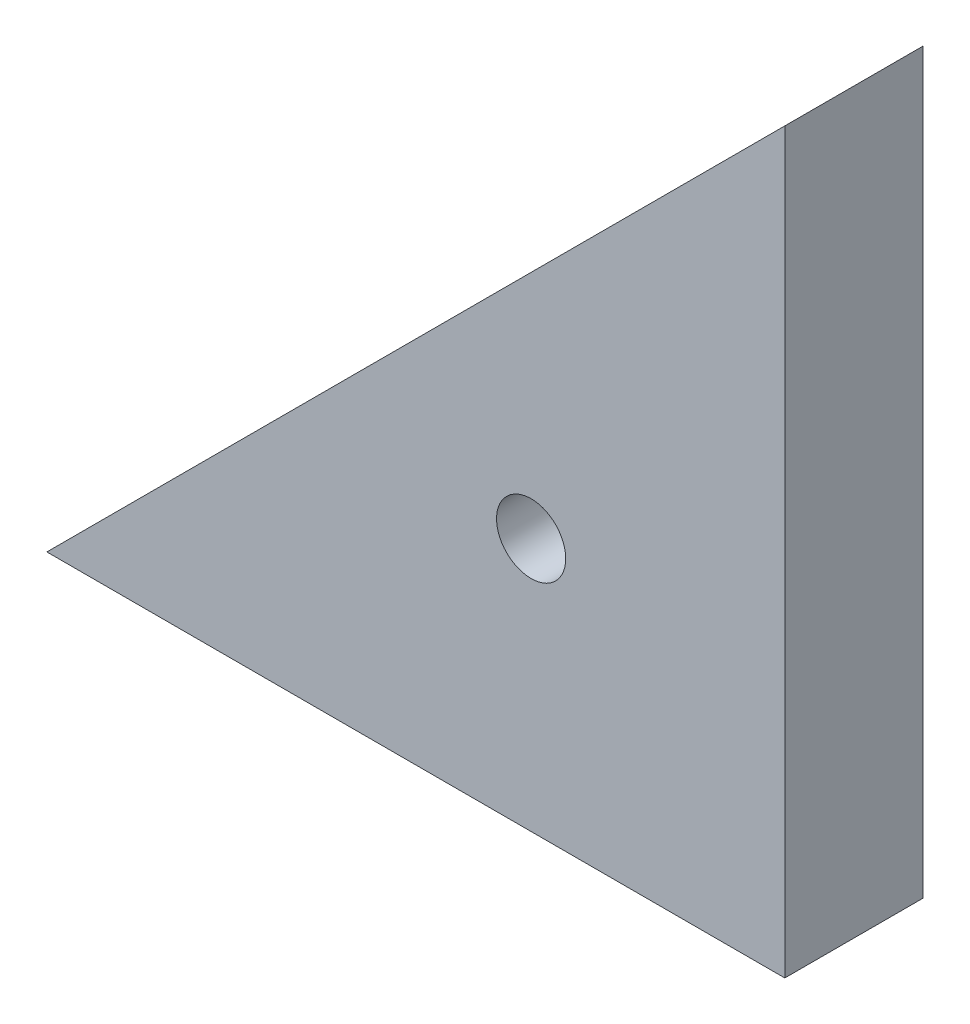
from build123d import *

# Parameters (mm, degrees)
ESBO_O1_R                = 1.5
RESSALTO_EXTRUS_O1_DEPTH = 6


with BuildPart() as part:
    # Esboço1 → Ressalto-extrusão1 (new body)
    with BuildSketch(Plane.XY):
        Polygon((-16, 0), (16, 0), (16, 32), align=None)
        with Locations((5, 11)):
            Circle(ESBO_O1_R, mode=Mode.SUBTRACT)
    extrude(amount=RESSALTO_EXTRUS_O1_DEPTH)


solid = part.part
